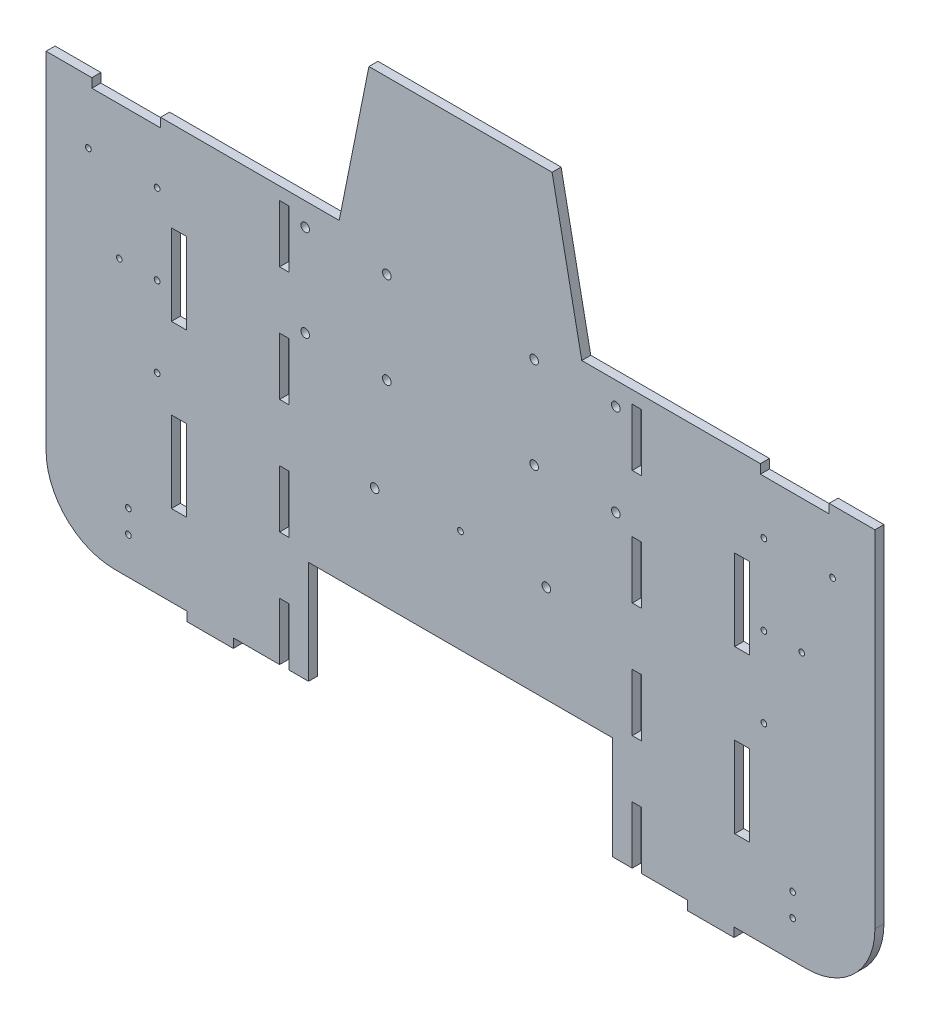
from build123d import *

# Parameters (mm, degrees)
SKETCH2_R           = 3.175
SKETCH2_R_2         = 4.7625
SKETCH2_W           = 16.516490401
SKETCH2_H           = 89.916
SKETCH2_W_2         = 10.16
SKETCH2_H_2         = 63.685061478
SKETCH2_H_3         = 63.685061479
BOSS_EXTRUDE1_DEPTH = 10


with BuildPart() as part:
    # Sketch2 → Boss-Extrude1 (new body)
    with BuildSketch(Plane.XY):
        with BuildLine():
            Line((-408.921789204, 152.75736057), (-459.721789204, 152.75736057))
            Line((-459.721789204, 152.75736057), (-459.721789204, -230.78263943))
            ThreePointArc((-459.721789204, -230.78263943), (-437.403325931, -284.664176156), (-383.521789204, -306.98263943))
            Line((-383.521789204, -306.98263943), (-303.521789204, -306.98263943))
            Line((-303.521789204, -306.98263943), (-303.521789204, -317.14263943))
            Line((-303.521789204, -317.14263943), (-252, -317.14263943))
            Line((-252, -317.14263943), (-252, -306.98263943))
            Line((-252, -306.98263943), (-200.66, -306.98263943))
            Line((-200.66, -306.98263943), (-200.66, -243.280152529))
            Line((-200.66, -243.280152529), (-190.5, -243.280152529))
            Line((-190.5, -243.280152529), (-190.5, -306.98263943))
            Line((-190.5, -306.98263943), (-168.529, -306.98263943))
            Line((-168.529, -306.98263943), (-168.529, -192.68263943))
            Line((-168.529, -192.68263943), (168.529, -192.68263943))
            Line((168.529, -192.68263943), (168.529, -306.98263943))
            Line((168.529, -306.98263943), (190.5, -306.98263943))
            Line((190.5, -306.98263943), (190.5, -243.280152529))
            Line((190.5, -243.280152529), (200.66, -243.280152529))
            Line((200.66, -243.280152529), (200.66, -306.98263943))
            Line((200.66, -306.98263943), (252, -306.98263943))
            Line((252, -306.98263943), (252, -317.14263943))
            Line((252, -317.14263943), (303.521789204, -317.14263943))
            Line((303.521789204, -317.14263943), (303.521789204, -306.98263943))
            Line((303.521789204, -306.98263943), (383.521789204, -306.98263943))
            ThreePointArc((383.521789204, -306.98263943), (437.403325931, -284.664176156), (459.721789204, -230.78263943))
            Line((459.721789204, -230.78263943), (459.721789204, 152.75736057))
            Line((459.721789204, 152.75736057), (408.921789204, 152.75736057))
            Line((408.921789204, 152.75736057), (408.921789204, 142.59736057))
            Line((408.921789204, 142.59736057), (332.721789204, 142.59736057))
            Line((332.721789204, 142.59736057), (332.721789204, 152.75736057))
            Line((332.721789204, 152.75736057), (134.539041792, 152.75736057))
            Line((134.539041792, 152.75736057), (101.6, 317.14263943))
            Line((101.6, 317.14263943), (-101.6, 317.14263943))
            Line((-101.6, 317.14263943), (-134.539041792, 152.75736057))
            Line((-134.539041792, 152.75736057), (-332.721789204, 152.75736057))
            Line((-332.721789204, 152.75736057), (-332.721789204, 142.597360571))
            Line((-332.721789204, 142.597360571), (-408.921789204, 142.597360571))
            Line((-408.921789204, 142.597360571), (-408.921789204, 152.75736057))
        make_face()
        with Locations((368.427, -265.98703943)):
            Circle(SKETCH2_R, mode=Mode.SUBTRACT)
        with Locations((368.427, -240.58703943)):
            Circle(SKETCH2_R, mode=Mode.SUBTRACT)
        with Locations((336.550272189, -94.687385458)):
            Circle(SKETCH2_R, mode=Mode.SUBTRACT)
        with Locations((378.573819589, -5.78737531)):
            Circle(SKETCH2_R, mode=Mode.SUBTRACT)
        with Locations((336.550272189, -5.787385458)):
            Circle(SKETCH2_R, mode=Mode.SUBTRACT)
        with Locations((336.550272189, 83.112614542)):
            Circle(SKETCH2_R, mode=Mode.SUBTRACT)
        with Locations((412.750272189, 83.112614542)):
            Circle(SKETCH2_R, mode=Mode.SUBTRACT)
        with Locations((-412.75027219, 83.112614542)):
            Circle(SKETCH2_R, mode=Mode.SUBTRACT)
        with Locations((-336.55027219, 83.112614542)):
            Circle(SKETCH2_R, mode=Mode.SUBTRACT)
        with Locations((-336.55027219, -5.787385458)):
            Circle(SKETCH2_R, mode=Mode.SUBTRACT)
        with Locations((-378.573819589, -5.78737531)):
            Circle(SKETCH2_R, mode=Mode.SUBTRACT)
        with Locations((-336.55027219, -94.687385458)):
            Circle(SKETCH2_R, mode=Mode.SUBTRACT)
        with Locations((-368.427, -240.58703943)):
            Circle(SKETCH2_R, mode=Mode.SUBTRACT)
        with Locations((-368.427, -265.98703943)):
            Circle(SKETCH2_R, mode=Mode.SUBTRACT)
        with Locations((172.2755, 127.35736057)):
            Circle(SKETCH2_R_2, mode=Mode.SUBTRACT)
        with Locations((172.2755, 25.75736057)):
            Circle(SKETCH2_R_2, mode=Mode.SUBTRACT)
        with Locations((81.7245, 25.75736057)):
            Circle(SKETCH2_R_2, mode=Mode.SUBTRACT)
        with Locations((81.7245, 127.35736057)):
            Circle(SKETCH2_R_2, mode=Mode.SUBTRACT)
        with Locations((-81.7245, 25.75736057)):
            Circle(SKETCH2_R_2, mode=Mode.SUBTRACT)
        with Locations((-81.7245, 127.35736057)):
            Circle(SKETCH2_R_2, mode=Mode.SUBTRACT)
        with Locations((-172.2755, 127.35736057)):
            Circle(SKETCH2_R_2, mode=Mode.SUBTRACT)
        with Locations((-172.2755, 25.75736057)):
            Circle(SKETCH2_R_2, mode=Mode.SUBTRACT)
        with Locations((0, -78.38263943)):
            Circle(SKETCH2_R, mode=Mode.SUBTRACT)
        with Locations((-95.25, -84.73263943)):
            Circle(SKETCH2_R_2, mode=Mode.SUBTRACT)
        with Locations((95.25, -84.73263943)):
            Circle(SKETCH2_R_2, mode=Mode.SUBTRACT)
        with Locations((312.416754739, 7.72336057)):
            Rectangle(SKETCH2_W, SKETCH2_H, mode=Mode.SUBTRACT)
        with Locations((312.416754739, -172.10863943)):
            Rectangle(SKETCH2_W, SKETCH2_H, mode=Mode.SUBTRACT)
        with Locations((-312.416754739, -172.10863943)):
            Rectangle(SKETCH2_W, SKETCH2_H, mode=Mode.SUBTRACT)
        with Locations((-312.416754739, 7.72336057)):
            Rectangle(SKETCH2_W, SKETCH2_H, mode=Mode.SUBTRACT)
        with Locations((195.58, -147.752560311)):
            Rectangle(SKETCH2_W_2, SKETCH2_H_2, mode=Mode.SUBTRACT)
        with Locations((195.58, -20.382437355)):
            Rectangle(SKETCH2_W_2, SKETCH2_H_3, mode=Mode.SUBTRACT)
        with Locations((195.58, 106.97026018)):
            Rectangle(SKETCH2_W_2, SKETCH2_H_3, mode=Mode.SUBTRACT)
        with Locations((-195.58, 106.97026018)):
            Rectangle(SKETCH2_W_2, SKETCH2_H_3, mode=Mode.SUBTRACT)
        with Locations((-195.58, -20.382437355)):
            Rectangle(SKETCH2_W_2, SKETCH2_H_3, mode=Mode.SUBTRACT)
        with Locations((-195.58, -147.752560311)):
            Rectangle(SKETCH2_W_2, SKETCH2_H_2, mode=Mode.SUBTRACT)
    extrude(amount=-BOSS_EXTRUDE1_DEPTH)


solid = part.part
